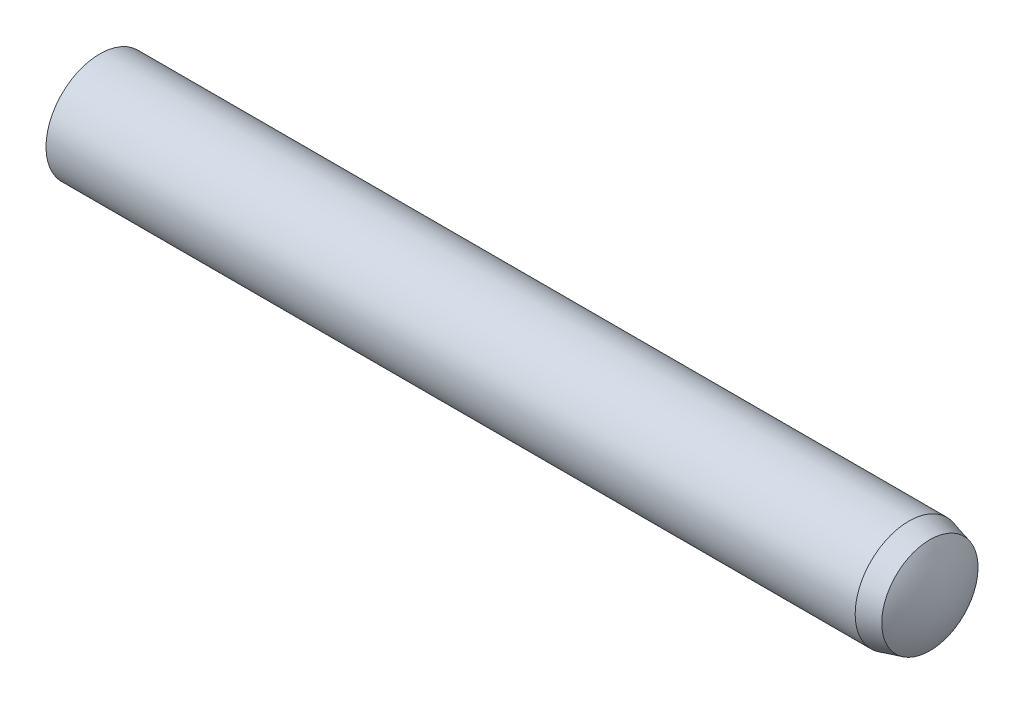
from build123d import *

# Parameters (mm, degrees)
EXTRUDE1_DEPTH      = 12
EXTRUDE1_DEPTH_BACK = 12
SKETCH2_R           = 1.5


with BuildPart() as part:
    # Sketch2 → Extrude1 (new, two sides: drawn at the far end of the back side and taken through both)
    with BuildSketch(Plane(origin=(0, 0, 0), x_dir=(0, 0, -1), z_dir=(1, 0, 0)).offset(-EXTRUDE1_DEPTH_BACK)):
        Circle(SKETCH2_R)
    extrude(amount=EXTRUDE1_DEPTH + EXTRUDE1_DEPTH_BACK)

    # Sketch5 → Cut-Revolve1 (revolve, cut)
    with BuildSketch(Plane.XY, mode=Mode.PRIVATE) as cut_revolve1_sk:
        with BuildLine():
            Line((11.025, 1.5), (11.025, 2))
            Line((11.025, 2), (12.5, 2))
            Line((12.5, 2), (12.5, 0))
            Line((12.5, 0), (12, 0))
            ThreePointArc((12, 0), (11.90052754, 0.699360389), (11.61, 1.343249722))
            Line((11.61, 1.343249722), (11.025, 1.5))
        make_face()
        with BuildLine():
            Line((-11.55, 1.5), (-11.55, 2))
            Line((-11.55, 2), (-12.5, 2))
            Line((-12.5, 2), (-12.5, 0))
            Line((-12.5, 0), (-12, 0))
            ThreePointArc((-12, 0), (-11.885076627, 0.783022988), (-11.55, 1.5))
        make_face()
    revolve(cut_revolve1_sk.sketch.rotate(Axis((-12, 0, 0), (1, 0, 0)), 90), axis=Axis((-12, 0, 0), (1, 0, 0)), mode=Mode.SUBTRACT)


solid = part.part
